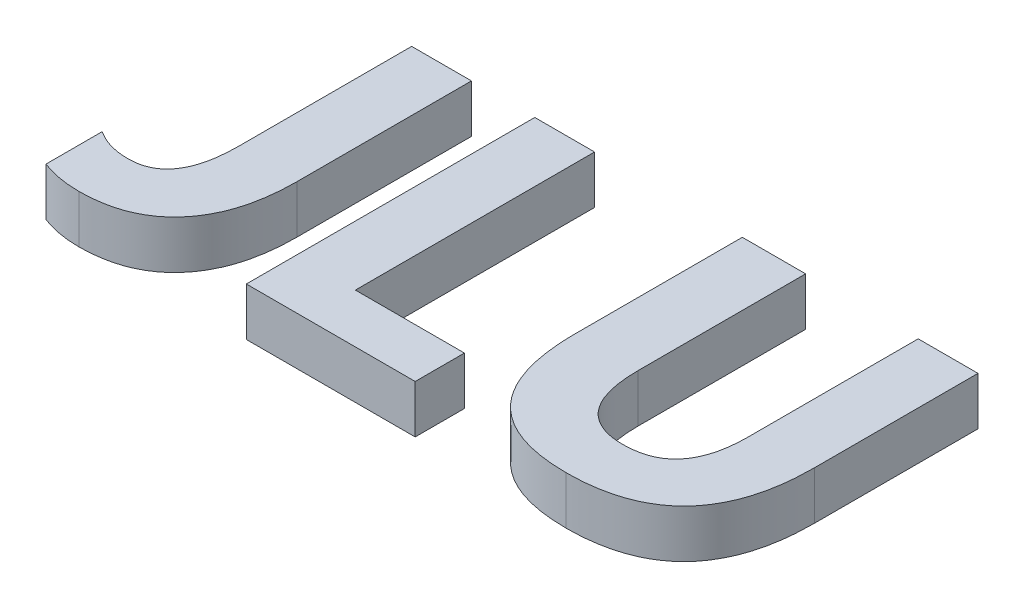
from build123d import *

# Parameters (mm, degrees)
EXTRUDE_1_DEPTH   = 5
EXTRUDE_1_2_DEPTH = 5
EXTRUDE_1_3_DEPTH = 5


with BuildPart() as part:
    # 草图1 → 凸台-拉伸1 (new body)
    with BuildSketch(Plane(origin=(0, 0, 0), x_dir=(1, 0, 0), z_dir=(0, 1, 0))):
        with BuildLine():
            add(Edge.make_bspline(
                [(15.365853659, 11.867378049), (15.359714143, 11.388754175), (15.34777692, 10.458153084), (15.211244414, 9.106167205), (15.002706243, 7.839290187), (14.715095668, 6.655120447), (14.332970611, 5.559401607), (13.859925734, 4.55214514), (13.312285096, 3.624848618), (12.674899746, 2.787160052), (11.960247142, 2.039406472), (11.164265164, 1.396545215), (10.298894503, 0.846582857), (9.357721104, 0.401042681), (8.342347892, 0.057481376), (7.255963883, -0.18599665), (6.096083165, -0.337220248), (5.29773224, -0.356135745), (4.88757622, -0.365853659)],
                knots=[0, 0, 0, 0, 1.252787689, 2.435828329, 3.553798052, 4.612612012, 5.622487692, 6.586703885, 7.52193139, 8.436978722, 9.336773741, 10.223513121, 11.109367792, 12.015434675, 12.943166183, 13.910230879, 14.926372652, 16, 16, 16, 16], degree=3))
            add(Edge.make_bspline(
                [(4.88757622, -0.365853659), (4.521195176, -0.357871677), (3.797001275, -0.342094379), (2.733703817, -0.192680967), (1.707538009, 0.035421939), (1.055540327, 0.267656977), (0.731707317, 0.383003049)],
                knots=[0, 0, 0, 0, 1.034892608, 2.045583223, 3.029283868, 4, 4, 4, 4], degree=3))
            Line((0.731707317, 0.383003049), (0.731707317, 6.219512195))
            add(Edge.make_bspline(
                [(0.731707317, 6.219512195), (1.01471884, 6.049920454), (1.579144924, 5.711693933), (2.516379223, 5.372711427), (3.505903389, 5.159406119), (4.187132684, 5.134567645), (4.533155488, 5.12195122)],
                knots=[0, 0, 0, 0, 0.984943231, 1.964328682, 2.966003513, 4, 4, 4, 4], degree=3))
            add(Edge.make_bspline(
                [(4.533155488, 5.12195122), (4.720164972, 5.127610952), (5.082640922, 5.138581075), (5.608957749, 5.218480357), (6.097637405, 5.357107978), (6.554677931, 5.545197073), (6.973457762, 5.79255926), (7.355917566, 6.094351317), (7.702292294, 6.450442897), (8.000845903, 6.868310794), (8.282709642, 7.327912824), (8.513128963, 7.850186322), (8.704351377, 8.42599057), (8.873082335, 9.05091247), (8.997218015, 9.733566303), (9.077296908, 10.471143259), (9.139465773, 11.260397367), (9.144003621, 11.80436062), (9.146341463, 12.084603659)],
                knots=[0, 0, 0, 0, 0.947883774, 1.837260146, 2.69043812, 3.517459016, 4.335860151, 5.147506513, 5.980933728, 6.844547187, 7.745752902, 8.709887714, 9.730166246, 10.819703769, 11.988689429, 13.243189077, 14.579725623, 16, 16, 16, 16], degree=3))
            Line((9.146341463, 12.084603659), (9.146341463, 30))
            Line((9.146341463, 30), (15.365853659, 30))
            Line((15.365853659, 30), (15.365853659, 11.867378049))
        make_face()
    extrude(amount=EXTRUDE_1_DEPTH)


with BuildPart() as body_2:
    # 草图1 → Extrude 1 2 (new body)
    with BuildSketch(Plane(origin=(0, 0, 0), x_dir=(1, 0, 0), z_dir=(0, 1, 0))):
        Polygon((39.512195122, 0), (21.951219512, 0), (21.951219512, 30), (28.170731707, 30), (28.170731707, 5.12195122), (39.512195122, 5.12195122), align=None)
    extrude(amount=EXTRUDE_1_2_DEPTH)


with BuildPart() as body_3:
    # 草图1 → Extrude 1 3 (new body)
    with BuildSketch(Plane(origin=(0, 0, 0), x_dir=(1, 0, 0), z_dir=(0, 1, 0))):
        with BuildLine():
            add(Edge.make_bspline(
                [(68.048780488, 12.987804878), (68.038453214, 12.448258877), (68.018453806, 11.403394542), (67.877460436, 9.885580867), (67.631936034, 8.47367009), (67.299183021, 7.160805712), (66.860134182, 5.95501179), (66.317646786, 4.855544135), (65.691843396, 3.850702018), (64.951792374, 2.959266592), (64.119444781, 2.168446752), (63.181561334, 1.491722462), (62.154063147, 0.90942498), (61.023647309, 0.442961438), (59.800281913, 0.075055544), (58.477930222, -0.174172886), (57.062175851, -0.340907214), (56.084735843, -0.357371508), (55.58117378, -0.365853659)],
                knots=[0, 0, 0, 0, 1.235970273, 2.393533182, 3.487949003, 4.515992742, 5.492359522, 6.421609714, 7.320200712, 8.197688609, 9.068473492, 9.9433408, 10.840509925, 11.7679436, 12.738791264, 13.761818313, 14.84692321, 16, 16, 16, 16], degree=3))
            add(Edge.make_bspline(
                [(55.58117378, -0.365853659), (55.094818522, -0.356720706), (54.150010293, -0.338978761), (52.781336736, -0.180940289), (51.504103167, 0.066133741), (50.321052821, 0.419002075), (49.231269892, 0.877695667), (48.237431368, 1.439664261), (47.333388641, 2.101713518), (46.531492419, 2.874663855), (45.815526399, 3.7429627), (45.203441798, 4.716658114), (44.68587711, 5.790997908), (44.266993374, 6.966763371), (43.933811725, 8.242201159), (43.705872632, 9.619893209), (43.559076455, 11.09627721), (43.544229734, 12.114719118), (43.536585366, 12.63910061)],
                knots=[0, 0, 0, 0, 1.148060148, 2.23025588, 3.248551608, 4.216496896, 5.139925816, 6.034536378, 6.906548873, 7.778503327, 8.657637241, 9.557628747, 10.487339234, 11.467969992, 12.500363046, 13.595861819, 14.762142881, 16, 16, 16, 16], degree=3))
            Line((43.536585366, 12.63910061), (43.536585366, 30))
            Line((43.536585366, 30), (50.12195122, 30))
            Line((50.12195122, 30), (50.12195122, 12.587652439))
            add(Edge.make_bspline(
                [(50.12195122, 12.587652439), (50.125979019, 12.286430181), (50.133790862, 11.702215085), (50.204165603, 10.854791493), (50.312874033, 10.064569644), (50.483130108, 9.334380345), (50.683964475, 8.65928118), (50.935435455, 8.040892169), (51.23902393, 7.486466147), (51.585201874, 6.985710714), (51.979166809, 6.546292366), (52.419303983, 6.161827763), (52.908968052, 5.841337226), (53.443261848, 5.578453606), (54.022088498, 5.370487914), (54.646934899, 5.222850963), (55.3196495, 5.137463485), (55.782906481, 5.127222289), (56.021341463, 5.12195122)],
                knots=[0, 0, 0, 0, 1.329763638, 2.579052408, 3.752249674, 4.848271385, 5.886243203, 6.859634421, 7.789624459, 8.671882452, 9.541777961, 10.388665663, 11.245070424, 12.11801215, 13.012224324, 13.955027817, 14.947467761, 16, 16, 16, 16], degree=3))
            add(Edge.make_bspline(
                [(56.021341463, 5.12195122), (56.256038599, 5.126897845), (56.71184416, 5.136504692), (57.371400342, 5.226125795), (57.990253302, 5.358795866), (58.560541463, 5.560430031), (59.088293744, 5.811859102), (59.566686889, 6.125470048), (60.004975486, 6.489949165), (60.387367979, 6.920893726), (60.735740084, 7.395497154), (61.026463257, 7.936425929), (61.27632455, 8.529899757), (61.483284006, 9.178043168), (61.634276076, 9.883217192), (61.748419073, 10.642886398), (61.816950956, 11.46025809), (61.825084087, 12.023496256), (61.829268293, 12.313262195)],
                knots=[0, 0, 0, 0, 1.06525563, 2.068834107, 3.017760966, 3.934579473, 4.809264905, 5.666133045, 6.525923798, 7.389754923, 8.276006946, 9.193845841, 10.171036594, 11.197302887, 12.278570952, 13.442422199, 14.684217483, 16, 16, 16, 16], degree=3))
            Line((61.829268293, 12.313262195), (61.829268293, 30))
            Line((61.829268293, 30), (68.048780488, 30))
            Line((68.048780488, 30), (68.048780488, 12.987804878))
        make_face()
    extrude(amount=EXTRUDE_1_3_DEPTH)


solid = Compound([part.part, body_2.part, body_3.part])
